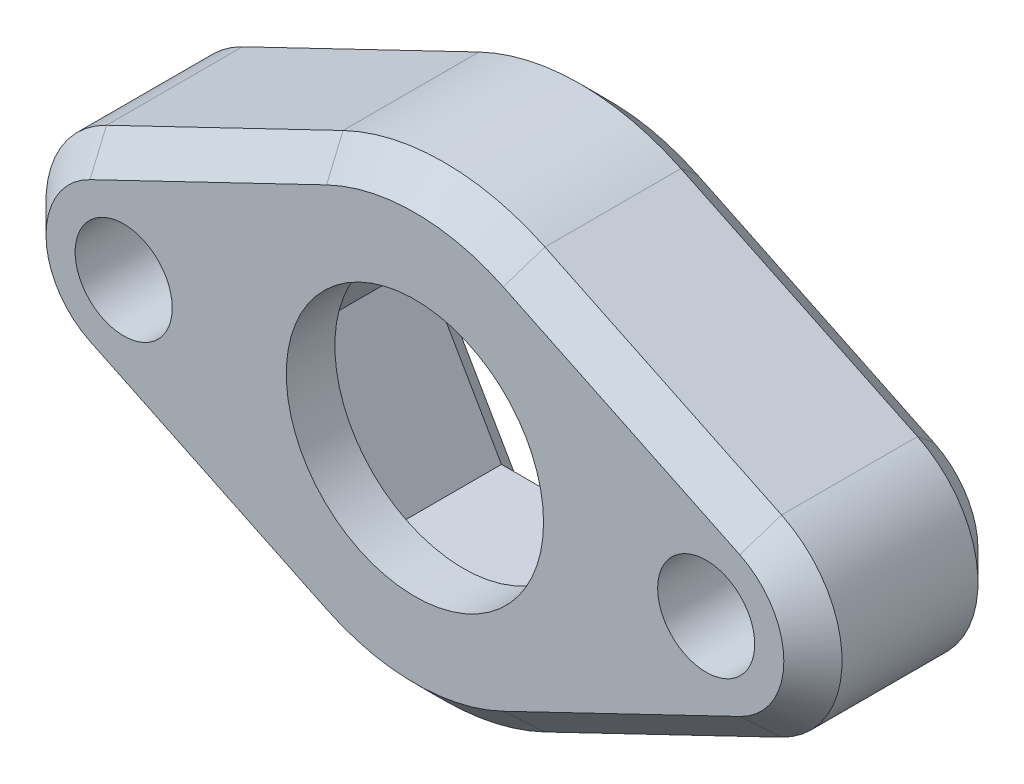
from build123d import *

# Parameters (mm, degrees)
SKETCH1_R           = 2.5
BOSS_EXTRUDE1_DEPTH = 10
SKETCH2_R           = 8.082903769
SKETCH2_R_2         = 6.625
BOSS_EXTRUDE3_DEPTH = 2.5
CHAMFER1_SIZE       = 1.5


with BuildPart() as part:
    # Sketch1 → Boss-Extrude1 (new body)
    with BuildSketch(Plane.XY):
        with BuildLine():
            Line((-5.2, -10.814804668), (-17.383333333, -4.956785473))
            ThreePointArc((-17.383333333, -4.956785473), (-20.5, 0), (-17.383333333, 4.956785473))
            Line((-17.383333333, 4.956785473), (-5.2, 10.814804668))
            ThreePointArc((-5.2, 10.814804668), (0, 12), (5.2, 10.814804668))
            Line((5.2, 10.814804668), (17.383333333, 4.956785473))
            ThreePointArc((17.383333333, 4.956785473), (20.5, 0), (17.383333333, -4.956785473))
            Line((17.383333333, -4.956785473), (5.2, -10.814804668))
            ThreePointArc((5.2, -10.814804668), (0, -12), (-5.2, -10.814804668))
        make_face()
        with Locations((-15, 0)):
            Circle(SKETCH1_R, mode=Mode.SUBTRACT)
        with Locations(Location((15, 0, 0), (0, 0, 180))):
            Circle(SKETCH1_R, mode=Mode.SUBTRACT)
        Polygon((8.082903769, 0), (4.041451884, 7), (-4.041451884, 7), (-8.082903769, 0), (-4.041451884, -7), (4.041451884, -7), align=None, mode=Mode.SUBTRACT)
    extrude(amount=BOSS_EXTRUDE1_DEPTH)

    # Sketch2 → Boss-Extrude3 (add)
    with BuildSketch(Plane.XY.offset(10)):
        Circle(SKETCH2_R)
        Circle(SKETCH2_R_2, mode=Mode.SUBTRACT)
    extrude(amount=-BOSS_EXTRUDE3_DEPTH)

    # Chamfer1
    chamfer1_edges = [part.edges().sort_by_distance(p)[0] for p in [
        (11.291666667, 7.88579507, 0),
        (20.5, 0, 0),
        (11.291666667, -7.88579507, 0),
        (0, -12, 0),
        (20.5, 0, 10),
        (11.291666667, 7.88579507, 10),
        (0, 12, 10),
        (-11.291666667, 7.88579507, 10),
        (-20.5, 0, 10),
        (6.062177826, -3.5, 0),
        (6.062177826, 3.5, 0),
        (0, 7, 0),
        (-6.062177826, 3.5, 0),
        (-6.062177826, -3.5, 0),
        (0, -7, 0),
        (-11.291666667, -7.88579507, 10),
        (0, -12, 10),
        (-11.291666667, -7.88579507, 0),
        (11.291666667, -7.88579507, 10),
        (-20.5, 0, 0),
        (-11.291666667, 7.88579507, 0),
        (0, 12, 0),
    ]]
    chamfer(chamfer1_edges, length=CHAMFER1_SIZE)


solid = part.part
